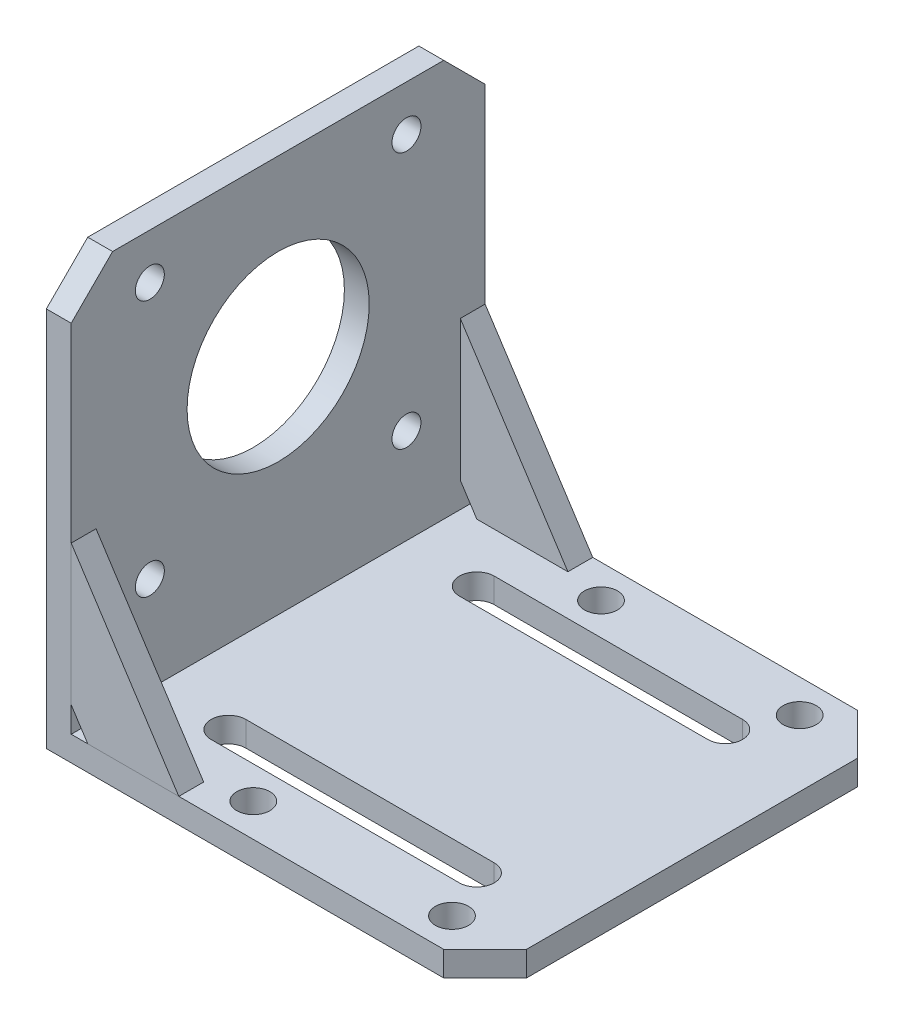
from build123d import *

# Parameters (mm, degrees)
BOSS_EXTRU_1_DEPTH      = 50
ESQUISSE2_R             = 1.75
ESQUISSE2_R_2           = 11
ENL_V_MAT_EXTRU_1_DEPTH = 89.938180777
CHANFREIN1_SIZE         = 5
ENL_V_MAT_EXTRU_2_DEPTH = 89.938180777
BOSS_EXTRU_2_DEPTH      = 3
BOSS_EXTRU_3_START      = -50
BOSS_EXTRU_3_DEPTH      = 3
ESQUISSE5_R             = 2
ENL_V_MAT_EXTRU_3_DEPTH = 88.252507127


with BuildPart() as part:
    # Esquisse1 → Boss.-Extru.1 (new body)
    with BuildSketch(Plane.XY):
        Polygon((0, 0), (53, 0), (53, 3), (3, 3), (3, 51), (0, 51), align=None)
    extrude(amount=BOSS_EXTRU_1_DEPTH)

    # Esquisse2 → Enlèv. mat.-Extru.1 (cut, through all)
    with BuildSketch(Plane.ZY):
        with Locations(Location((9.5, 45.5, 0), (0, 0, 270))):
            Circle(ESQUISSE2_R)
        with Locations(Location((40.5, 45.5, 0), (0, 0, 270))):
            Circle(ESQUISSE2_R)
        with Locations(Location((40.5, 14.5, 0), (0, 0, 270))):
            Circle(ESQUISSE2_R)
        with Locations(Location((9.5, 14.5, 0), (0, 0, 270))):
            Circle(ESQUISSE2_R)
        with Locations(Location((25, 30, 0), (0, 0, 270))):
            Circle(ESQUISSE2_R_2)
    extrude(amount=-ENL_V_MAT_EXTRU_1_DEPTH, mode=Mode.SUBTRACT)

    # Chanfrein1
    chanfrein1_edges = [part.edges().sort_by_distance(p)[0] for p in [
        (53, 1.5, 50),
        (1.5, 51, 50),
        (1.5, 51, 0),
        (53, 1.5, 0),
    ]]
    chamfer(chanfrein1_edges, length=CHANFREIN1_SIZE)

    # Esquisse3 → Enlèv. mat.-Extru.2 (cut, through all)
    with BuildSketch(Plane.XZ):
        with BuildLine():
            Line((12, 42.1), (42, 42.1))
            ThreePointArc((42, 42.1), (44.1, 40), (42, 37.9))
            Line((42, 37.9), (12, 37.9))
            ThreePointArc((12, 37.9), (9.9, 40), (12, 42.1))
        make_face()
        with BuildLine():
            Line((12, 7.9), (42, 7.9))
            ThreePointArc((42, 7.9), (44.1, 10), (42, 12.1))
            Line((42, 12.1), (12, 12.1))
            ThreePointArc((12, 12.1), (9.9, 10), (12, 7.9))
        make_face()
    extrude(amount=-ENL_V_MAT_EXTRU_2_DEPTH, mode=Mode.SUBTRACT)

    # Esquisse5 → Enlèv. mat.-Extru.3 (cut, through all)
    with BuildSketch(Plane(origin=(0, 3, 0), x_dir=(1, 0, 0), z_dir=(0, 1, 0))):
        with Locations(Location((45, -4, 0), (0, 0, 180))):
            Circle(ESQUISSE5_R)
        with Locations((45, -46)):
            Circle(ESQUISSE5_R)
        with Locations(Location((21, -46, 0), (0, 0, 180))):
            Circle(ESQUISSE5_R)
        with Locations((21, -4)):
            Circle(ESQUISSE5_R)
    extrude(amount=-ENL_V_MAT_EXTRU_3_DEPTH, mode=Mode.SUBTRACT)


with BuildPart() as body_2:
    # Esquisse4 → Boss.-Extru.2 (new body)
    with BuildSketch(Plane.XY.offset(50)):
        Polygon((3, 23), (16, 3), (5, 3), (3, 6.076923077), align=None)
    extrude(amount=-BOSS_EXTRU_2_DEPTH)


with BuildPart() as body_3:
    # Esquisse4<2> → Boss.-Extru.3 (new body)
    with BuildSketch(Plane.XY.offset(50).offset(BOSS_EXTRU_3_START)):
        Polygon((3, 23), (16, 3), (5, 3), (3, 6.076923077), align=None)
    extrude(amount=BOSS_EXTRU_3_DEPTH)


solid = Compound([part.part, body_2.part, body_3.part])
